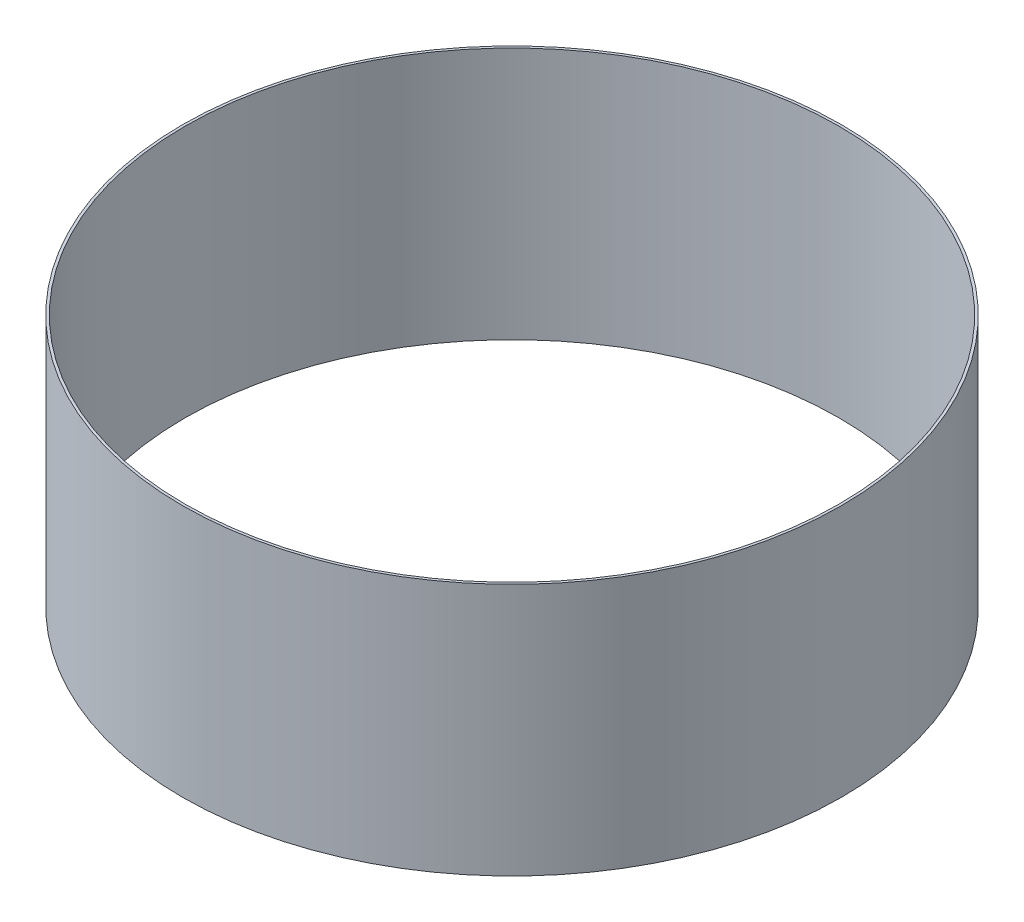
from build123d import *

# Parameters (mm, degrees)
ESQUISSE1_R      = 32.625
ESQUISSE1_R_2    = 32.375
EXTRUSION1_DEPTH = 25


with BuildPart() as part:
    # Esquisse1 → Extrusion1 (new body)
    with BuildSketch(Plane(origin=(0, 0, 0), x_dir=(1, 0, 0), z_dir=(0, 1, 0))):
        with Locations(Location((0, 0, 0), (0, 0, 270))):
            Circle(ESQUISSE1_R)
        with Locations(Location((0, 0, 0), (0, 0, 270))):
            Circle(ESQUISSE1_R_2, mode=Mode.SUBTRACT)
    extrude(amount=EXTRUSION1_DEPTH)


solid = part.part
